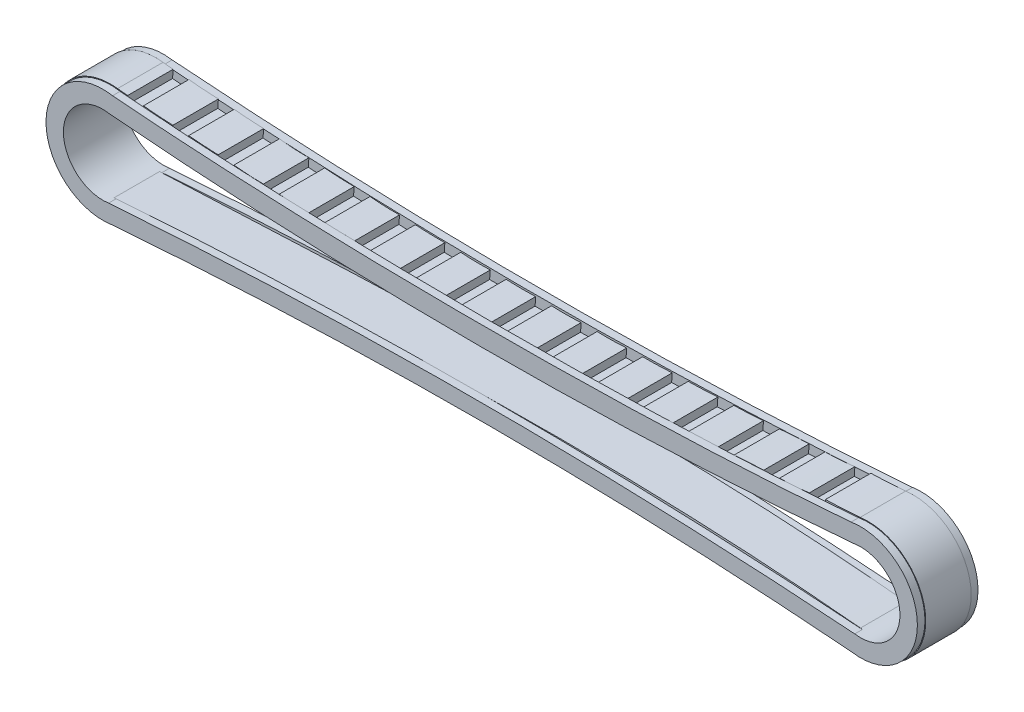
from build123d import *
from build123d.topology import SkipClean

# Parameters (mm, degrees)
BOSS_EXTRUDE1_DEPTH = 30
BOSS_EXTRUDE2_DEPTH = 5
BOSS_EXTRUDE3_START = 5
BOSS_EXTRUDE3_DEPTH = 5


with BuildPart() as part:
    # Sketch2 → Boss-Extrude1 (new body)
    with BuildSketch(Plane.XY):
        with BuildLine():
            Line((-238.998821931, 31.569594808), (-238.586784418, 37.10127655))
            ThreePointArc((-238.586784418, 37.10127655), (-241.931710266, 37.344330699), (-245.266114933, 37.703982975))
            ThreePointArc((-245.266114933, 37.703982975), (-287.989089195, 0.910550459), (-247.077946918, -37.887486137))
            Line((-247.077946918, -37.887486137), (-245.266114933, -37.703982975))
            ThreePointArc((-245.266114933, -37.703982975), (-241.931710266, -37.344330699), (-238.586784418, -37.10127655))
            Line((-238.586784418, -37.10127655), (-238.998821931, -31.569594808))
            add(Edge.make_bspline(
                [(-238.998821931, -31.569594808), (-235.514987298, -31.309699432), (-232.042874885, -31.053245865), (-228.581475166, -30.800398489)],
                knots=[0.02022379, 0.02022379, 0.02022379, 0.02022379, 0.042026375, 0.042026375, 0.042026375, 0.042026375], degree=3))
            Line((-228.581475166, -30.800398489), (-228.172584214, -36.40781281))
            ThreePointArc((-228.172584214, -36.40781281), (-218.470399221, -35.528641015), (-208.741604112, -35.022792798))
            Line((-208.741604112, -35.022792798), (-209.159444416, -29.413207493))
            add(Edge.make_bspline(
                [(-209.159444416, -29.413207493), (-205.675812604, -29.170396225), (-202.201300992, -28.931636256), (-198.73484701, -28.697100604)],
                knots=[0.083029278, 0.083029278, 0.083029278, 0.083029278, 0.105207191, 0.105207191, 0.105207191, 0.105207191], degree=3))
            Line((-198.73484701, -28.697100604), (-198.32562478, -34.309057968))
            ThreePointArc((-198.32562478, -34.309057968), (-188.617482185, -33.521350979), (-178.889417216, -33.038373859))
            Line((-178.889417216, -33.038373859), (-179.30767906, -27.423129293))
            add(Edge.make_bspline(
                [(-179.30767906, -27.423129293), (-175.824275251, -27.202294902), (-172.347090226, -26.986124949), (-168.875020653, -26.774799091)],
                knots=[0.146804407, 0.146804407, 0.146804407, 0.146804407, 0.169262369, 0.169262369, 0.169262369, 0.169262369], degree=3))
            Line((-168.875020653, -26.774799091), (-168.465344429, -32.392982419))
            ThreePointArc((-168.465344429, -32.392982419), (-158.759656192, -31.549674077), (-149.02159256, -31.263894792))
            Line((-149.02159256, -31.263894792), (-149.440416727, -25.64110094))
            add(Edge.make_bspline(
                [(-149.440416727, -25.64110094), (-145.957213896, -25.447051762), (-142.477109799, -25.258262133), (-138.998975623, -25.074915856)],
                knots=[0.211264698, 0.211264698, 0.211264698, 0.211264698, 0.233894228, 0.233894228, 0.233894228, 0.233894228], degree=3))
            Line((-138.998975623, -25.074915856), (-138.588700928, -30.701306436))
            ThreePointArc((-138.588700928, -30.701306436), (-128.872257504, -30.011221888), (-119.135123678, -29.739718012))
            Line((-119.135123678, -29.739718012), (-119.472657229, -25.208266089))
            Line((-119.472657229, -25.208266089), (-119.554671569, -24.107208014))
            add(Edge.make_bspline(
                [(-119.554671569, -24.107208014), (-116.052071462, -23.9434984), (-112.549334144, -23.785668138), (-109.045303404, -23.633905496)],
                knots=[0.276092607, 0.276092607, 0.276092607, 0.276092607, 0.298903759, 0.298903759, 0.298903759, 0.298903759], degree=3))
            Line((-109.045303404, -23.633905496), (-109.045303404, -24.439589833))
            Line((-109.045303404, -24.439589833), (-108.69283219, -29.273279905))
            ThreePointArc((-108.69283219, -29.273279905), (-98.970667218, -28.620073429), (-89.227295134, -28.502298743))
            Line((-89.227295134, -28.502298743), (-89.472657229, -25.208266089))
            Line((-89.472657229, -25.208266089), (-89.647743917, -22.857694114))
            add(Edge.make_bspline(
                [(-89.647743917, -22.857694114), (-86.117447327, -22.728296314), (-82.583691705, -22.605377494), (-79.045303404, -22.489128759)],
                knots=[0.340951975, 0.340951975, 0.340951975, 0.340951975, 0.363877217, 0.363877217, 0.363877217, 0.363877217], degree=3))
            Line((-79.045303404, -22.489128759), (-79.045303404, -24.439589833))
            Line((-79.045303404, -24.439589833), (-78.775215725, -28.143495512))
            ThreePointArc((-78.775215725, -28.143495512), (-69.040667815, -27.684345011), (-59.295833248, -27.582161566))
            Line((-59.295833248, -27.582161566), (-59.472657229, -25.208266089))
            Line((-59.472657229, -25.208266089), (-59.717366768, -21.922994133))
            add(Edge.make_bspline(
                [(-59.717366768, -21.922994133), (-56.167130834, -21.831825833), (-52.610164685, -21.747639789), (-49.045303403, -21.670625684)],
                knots=[0.405505021, 0.405505021, 0.405505021, 0.405505021, 0.428373281, 0.428373281, 0.428373281, 0.428373281], degree=3))
            Line((-49.045303403, -21.670625684), (-49.045303404, -24.439589833))
            Line((-49.045303404, -24.439589833), (-48.833805347, -27.340014089))
            ThreePointArc((-48.833805347, -27.340014089), (-39.090991591, -26.90665667), (-29.339015138, -27.002436507))
            Line((-29.339015138, -27.002436507), (-29.472657229, -25.208266089))
            Line((-29.472657229, -25.208266089), (-29.761814532, -21.326274758))
            add(Edge.make_bspline(
                [(-29.761814532, -21.326274758), (-26.199814592, -21.276116535), (-22.62802131, -21.233325454), (-19.045303404, -21.198085722)],
                knots=[0.469429562, 0.469429562, 0.469429562, 0.469429562, 0.492075527, 0.492075527, 0.492075527, 0.492075527], degree=3))
            Line((-19.045303404, -21.198085722), (-19.045303404, -24.439589833))
            Line((-19.045303404, -24.439589833), (-18.867119733, -26.883150068))
            ThreePointArc((-18.867119733, -26.883150068), (-9.112521987, -26.626736493), (0.644271849, -26.778061131))
            Line((0.644271849, -26.778061131), (0.527342771, -25.208266089))
            Line((0.527342771, -25.208266089), (0.220040245, -21.082671423))
            add(Edge.make_bspline(
                [(0.220040245, -21.082671423), (3.785383745, -21.07505994), (7.363243824, -21.075069823), (10.954696594, -21.082876295)],
                knots=[0.532434088, 0.532434088, 0.532434088, 0.532434088, 0.554705836, 0.554705836, 0.554705836, 0.554705836], degree=3))
            Line((10.954696594, -21.082876295), (10.954696596, -24.439589833))
            Line((10.954696596, -24.439589833), (11.125716762, -26.784911789))
            ThreePointArc((11.125716762, -26.784911789), (20.892293503, -26.526542749), (30.654530324, -26.915783104))
            Line((30.654530324, -26.915783104), (30.527342771, -25.208266089))
            Line((30.527342771, -25.208266089), (30.228725057, -21.199266967))
            add(Edge.make_bspline(
                [(30.228725057, -21.199266967), (33.788907919, -21.234504639), (37.363897011, -21.277485125), (40.954696595, -21.328371949)],
                knots=[0.594268852, 0.594268852, 0.594268852, 0.594268852, 0.616033455, 0.616033455, 0.616033455, 0.616033455], degree=3))
            Line((40.954696595, -21.328371949), (40.954696596, -24.439589833))
            Line((40.954696596, -24.439589833), (41.144996444, -27.049307873))
            ThreePointArc((41.144996444, -27.049307873), (50.923457407, -26.958973121), (60.691703902, -27.414845445))
            Line((60.691703902, -27.414845445), (60.527342771, -25.208266089))
            Line((60.527342771, -25.208266089), (60.26421433, -21.675717091))
            add(Edge.make_bspline(
                [(60.26421433, -21.675717091), (63.810790106, -21.752979285), (67.373977147, -21.837979776), (70.954696596, -21.930868555)],
                knots=[0.654732118, 0.654732118, 0.654732118, 0.654732118, 0.675878863, 0.675878863, 0.675878863, 0.675878863], degree=3))
            Line((70.954696596, -21.930868555), (70.954696596, -24.439589833))
            Line((70.954696596, -24.439589833), (71.190488941, -27.673179044))
            ThreePointArc((71.190488941, -27.673179044), (80.978326974, -27.791319319), (90.755259786, -28.26809524))
            Line((90.755259786, -28.26809524), (90.527342771, -25.208266089))
            Line((90.527342771, -25.208266089), (90.326009866, -22.505333783))
            add(Edge.make_bspline(
                [(90.326009866, -22.505333783), (93.850707609, -22.622842057), (97.393325851, -22.747971609), (100.954696596, -22.880857913)],
                knots=[0.713671686, 0.713671686, 0.713671686, 0.713671686, 0.734113038, 0.734113038, 0.734113038, 0.734113038], degree=3))
            Line((100.954696596, -22.880857913), (100.954696596, -24.439589833))
            Line((100.954696596, -24.439589833), (101.261531792, -28.647440517))
            ThreePointArc((101.261531792, -28.647440517), (111.058477929, -28.921806336), (120.844291485, -29.463362671))
            Line((120.844291485, -29.463362671), (120.527342771, -25.208266089))
            Line((120.527342771, -25.208266089), (120.413239395, -23.676406684))
            add(Edge.make_bspline(
                [(120.413239395, -23.676406684), (123.908056371, -23.831634074), (127.421628301, -23.994270693), (130.954696596, -24.164437269)],
                knots=[0.770982548, 0.770982548, 0.770982548, 0.770982548, 0.790653311, 0.790653311, 0.790653311, 0.790653311], degree=3))
            Line((130.954696596, -24.164437269), (130.954696596, -24.439589833))
            Line((130.954696596, -24.439589833), (131.357132737, -29.958484713))
            ThreePointArc((131.357132737, -29.958484713), (141.16480491, -30.329821804), (150.957622027, -30.984846691))
            Line((150.957622027, -30.984846691), (150.527342771, -25.208266089))
            Line((150.527342771, -25.208266089), (150.524758013, -25.173565233))
            add(Edge.make_bspline(
                [(150.524758013, -25.173565233), (154.014012181, -25.365201145), (157.522780664, -25.56409067), (161.051734721, -25.770343106)],
                knots=[0.826601903, 0.826601903, 0.826601903, 0.826601903, 0.845631572, 0.845631572, 0.845631572, 0.845631572], degree=3))
            Line((161.051734721, -25.770343106), (161.476069116, -31.589544412))
            ThreePointArc((161.476069116, -31.589544412), (171.278353035, -32.308203291), (181.093901171, -32.814420038))
            Line((181.093901171, -32.814420038), (180.659241959, -26.979037702))
            add(Edge.make_bspline(
                [(180.659241959, -26.979037702), (184.149520886, -27.205196053), (187.659872042, -27.438443165), (191.190904523, -27.678878222)],
                knots=[0.880502735, 0.880502735, 0.880502735, 0.880502735, 0.898925873, 0.898925873, 0.898925873, 0.898925873], degree=3))
            Line((191.190904523, -27.678878222), (191.616978023, -33.521929131))
            ThreePointArc((191.616978023, -33.521929131), (201.459551294, -33.876287808), (211.251683623, -34.932679365))
            Line((211.251683623, -34.932679365), (210.815268509, -29.073723721))
            add(Edge.make_bspline(
                [(210.815268509, -29.073723721), (214.306482428, -29.332127355), (217.818095675, -29.597427957), (221.3506597, -29.86971532)],
                knots=[0.932686984, 0.932686984, 0.932686984, 0.932686984, 0.95050946, 0.95050946, 0.95050946, 0.95050946], degree=3))
            Line((221.3506597, -29.86971532), (221.827415786, -36.40781281))
            ThreePointArc((221.827415786, -36.40781281), (233.272455942, -36.896233186), (244.70443965, -37.629204623))
            ThreePointArc((244.70443965, -37.629204623), (288, 0), (244.70443965, 37.629204623))
            ThreePointArc((244.70443965, 37.629204623), (233.272455942, 36.896233186), (221.827415786, 36.40781281))
            Line((221.827415786, 36.40781281), (221.3506597, 29.86971532))
            add(Edge.make_bspline(
                [(210.815268509, 29.073723721), (214.306482428, 29.332127355), (217.818095675, 29.597427957), (221.3506597, 29.86971532)],
                knots=[0.932686984, 0.932686984, 0.932686984, 0.932686984, 0.95050946, 0.95050946, 0.95050946, 0.95050946], degree=3))
            Line((210.815268509, 29.073723721), (211.251683623, 34.932679365))
            ThreePointArc((211.251683623, 34.932679365), (201.459551294, 33.876287808), (191.616978023, 33.521929131))
            Line((191.616978023, 33.521929131), (191.190904523, 27.678878222))
            add(Edge.make_bspline(
                [(180.659241959, 26.979037702), (184.149520886, 27.205196053), (187.659872042, 27.438443165), (191.190904523, 27.678878222)],
                knots=[0.880502735, 0.880502735, 0.880502735, 0.880502735, 0.898925873, 0.898925873, 0.898925873, 0.898925873], degree=3))
            Line((180.659241959, 26.979037702), (181.093901171, 32.814420038))
            ThreePointArc((181.093901171, 32.814420038), (171.278353035, 32.308203291), (161.476069116, 31.589544412))
            Line((161.476069116, 31.589544412), (161.051734721, 25.770343106))
            add(Edge.make_bspline(
                [(150.524758013, 25.173565233), (154.014012181, 25.365201145), (157.522780664, 25.56409067), (161.051734721, 25.770343106)],
                knots=[0.826601903, 0.826601903, 0.826601903, 0.826601903, 0.845631572, 0.845631572, 0.845631572, 0.845631572], degree=3))
            Line((150.524758013, 25.173565233), (150.527342771, 25.208266089))
            Line((150.527342771, 25.208266089), (150.957622027, 30.984846691))
            ThreePointArc((150.957622027, 30.984846691), (141.16480491, 30.329821804), (131.357132737, 29.958484713))
            Line((131.357132737, 29.958484713), (130.954696596, 24.439589833))
            Line((130.954696596, 24.439589833), (130.954696596, 24.164437269))
            add(Edge.make_bspline(
                [(120.413239395, 23.676406684), (123.908056371, 23.831634074), (127.421628301, 23.994270693), (130.954696596, 24.164437269)],
                knots=[0.770982548, 0.770982548, 0.770982548, 0.770982548, 0.790653311, 0.790653311, 0.790653311, 0.790653311], degree=3))
            Line((120.413239395, 23.676406684), (120.527342771, 25.208266089))
            Line((120.527342771, 25.208266089), (120.844291485, 29.463362671))
            ThreePointArc((120.844291485, 29.463362671), (111.058477929, 28.921806336), (101.261531792, 28.647440517))
            Line((101.261531792, 28.647440517), (100.954696596, 24.439589833))
            Line((100.954696596, 24.439589833), (100.954696596, 22.880857913))
            add(Edge.make_bspline(
                [(90.326009866, 22.505333783), (93.850707609, 22.622842057), (97.393325851, 22.747971609), (100.954696596, 22.880857913)],
                knots=[0.713671686, 0.713671686, 0.713671686, 0.713671686, 0.734113038, 0.734113038, 0.734113038, 0.734113038], degree=3))
            Line((90.326009866, 22.505333783), (90.527342771, 25.208266089))
            Line((90.527342771, 25.208266089), (90.755259786, 28.26809524))
            ThreePointArc((90.755259786, 28.26809524), (80.978326974, 27.791319319), (71.190488941, 27.673179044))
            Line((71.190488941, 27.673179044), (70.954696596, 24.439589833))
            Line((70.954696596, 24.439589833), (70.954696596, 21.930868555))
            add(Edge.make_bspline(
                [(60.26421433, 21.675717091), (63.810790106, 21.752979285), (67.373977147, 21.837979776), (70.954696596, 21.930868555)],
                knots=[0.654732118, 0.654732118, 0.654732118, 0.654732118, 0.675878863, 0.675878863, 0.675878863, 0.675878863], degree=3))
            Line((60.26421433, 21.675717091), (60.527342771, 25.208266089))
            Line((60.527342771, 25.208266089), (60.691703902, 27.414845445))
            ThreePointArc((60.691703902, 27.414845445), (50.923457407, 26.958973121), (41.144996444, 27.049307873))
            Line((41.144996444, 27.049307873), (40.954696596, 24.439589833))
            Line((40.954696596, 24.439589833), (40.954696595, 21.328371949))
            add(Edge.make_bspline(
                [(30.228725057, 21.199266967), (33.788907919, 21.234504639), (37.363897011, 21.277485125), (40.954696595, 21.328371949)],
                knots=[0.594268852, 0.594268852, 0.594268852, 0.594268852, 0.616033455, 0.616033455, 0.616033455, 0.616033455], degree=3))
            Line((30.228725057, 21.199266967), (30.527342771, 25.208266089))
            Line((30.527342771, 25.208266089), (30.654530324, 26.915783104))
            ThreePointArc((30.654530324, 26.915783104), (20.892293503, 26.526542749), (11.125716762, 26.784911789))
            Line((11.125716762, 26.784911789), (10.954696596, 24.439589833))
            Line((10.954696596, 24.439589833), (10.954696594, 21.082876295))
            add(Edge.make_bspline(
                [(0.220040245, 21.082671423), (3.785383745, 21.07505994), (7.363243824, 21.075069823), (10.954696594, 21.082876295)],
                knots=[0.532434088, 0.532434088, 0.532434088, 0.532434088, 0.554705836, 0.554705836, 0.554705836, 0.554705836], degree=3))
            Line((0.220040245, 21.082671423), (0.527342771, 25.208266089))
            Line((0.527342771, 25.208266089), (0.644271849, 26.778061131))
            ThreePointArc((0.644271849, 26.778061131), (-9.112521987, 26.626736493), (-18.867119733, 26.883150068))
            Line((-18.867119733, 26.883150068), (-19.045303404, 24.439589833))
            Line((-19.045303404, 24.439589833), (-19.045303404, 21.198085722))
            add(Edge.make_bspline(
                [(-29.761814532, 21.326274758), (-26.199814592, 21.276116535), (-22.62802131, 21.233325454), (-19.045303404, 21.198085722)],
                knots=[0.469429562, 0.469429562, 0.469429562, 0.469429562, 0.492075527, 0.492075527, 0.492075527, 0.492075527], degree=3))
            Line((-29.761814532, 21.326274758), (-29.472657229, 25.208266089))
            Line((-29.472657229, 25.208266089), (-29.339015138, 27.002436507))
            ThreePointArc((-29.339015138, 27.002436507), (-39.090991591, 26.90665667), (-48.833805347, 27.340014089))
            Line((-48.833805347, 27.340014089), (-49.045303404, 24.439589833))
            Line((-49.045303404, 24.439589833), (-49.045303403, 21.670625684))
            add(Edge.make_bspline(
                [(-59.717366768, 21.922994133), (-56.167130834, 21.831825833), (-52.610164685, 21.747639789), (-49.045303403, 21.670625684)],
                knots=[0.405505021, 0.405505021, 0.405505021, 0.405505021, 0.428373281, 0.428373281, 0.428373281, 0.428373281], degree=3))
            Line((-59.717366768, 21.922994133), (-59.472657229, 25.208266089))
            Line((-59.472657229, 25.208266089), (-59.295833248, 27.582161566))
            ThreePointArc((-59.295833248, 27.582161566), (-69.040667815, 27.684345011), (-78.775215725, 28.143495512))
            Line((-78.775215725, 28.143495512), (-79.045303404, 24.439589833))
            Line((-79.045303404, 24.439589833), (-79.045303404, 22.489128759))
            add(Edge.make_bspline(
                [(-89.647743917, 22.857694114), (-86.117447327, 22.728296314), (-82.583691705, 22.605377494), (-79.045303404, 22.489128759)],
                knots=[0.340951975, 0.340951975, 0.340951975, 0.340951975, 0.363877217, 0.363877217, 0.363877217, 0.363877217], degree=3))
            Line((-89.647743917, 22.857694114), (-89.472657229, 25.208266089))
            Line((-89.472657229, 25.208266089), (-89.227295134, 28.502298743))
            ThreePointArc((-89.227295134, 28.502298743), (-98.970667218, 28.620073429), (-108.69283219, 29.273279905))
            Line((-108.69283219, 29.273279905), (-109.045303404, 24.439589833))
            Line((-109.045303404, 24.439589833), (-109.045303404, 23.633905496))
            add(Edge.make_bspline(
                [(-119.554671569, 24.107208014), (-116.052071462, 23.9434984), (-112.549334144, 23.785668138), (-109.045303404, 23.633905496)],
                knots=[0.276092607, 0.276092607, 0.276092607, 0.276092607, 0.298903759, 0.298903759, 0.298903759, 0.298903759], degree=3))
            Line((-119.554671569, 24.107208014), (-119.472657229, 25.208266089))
            Line((-119.472657229, 25.208266089), (-119.135123678, 29.739718012))
            ThreePointArc((-119.135123678, 29.739718012), (-128.872257504, 30.011221888), (-138.588700928, 30.701306436))
            Line((-138.588700928, 30.701306436), (-138.998975623, 25.074915856))
            add(Edge.make_bspline(
                [(-149.440416727, 25.64110094), (-145.957213896, 25.447051762), (-142.477109799, 25.258262133), (-138.998975623, 25.074915856)],
                knots=[0.211264698, 0.211264698, 0.211264698, 0.211264698, 0.233894228, 0.233894228, 0.233894228, 0.233894228], degree=3))
            Line((-149.440416727, 25.64110094), (-149.02159256, 31.263894792))
            ThreePointArc((-149.02159256, 31.263894792), (-158.759656192, 31.549674077), (-168.465344429, 32.392982419))
            Line((-168.465344429, 32.392982419), (-168.875020653, 26.774799091))
            add(Edge.make_bspline(
                [(-179.30767906, 27.423129293), (-175.824275251, 27.202294902), (-172.347090226, 26.986124949), (-168.875020653, 26.774799091)],
                knots=[0.146804407, 0.146804407, 0.146804407, 0.146804407, 0.169262369, 0.169262369, 0.169262369, 0.169262369], degree=3))
            Line((-179.30767906, 27.423129293), (-178.889417216, 33.038373859))
            ThreePointArc((-178.889417216, 33.038373859), (-188.617482185, 33.521350979), (-198.32562478, 34.309057968))
            Line((-198.32562478, 34.309057968), (-198.73484701, 28.697100604))
            add(Edge.make_bspline(
                [(-209.159444416, 29.413207493), (-205.675812604, 29.170396225), (-202.201300992, 28.931636256), (-198.73484701, 28.697100604)],
                knots=[0.083029278, 0.083029278, 0.083029278, 0.083029278, 0.105207191, 0.105207191, 0.105207191, 0.105207191], degree=3))
            Line((-209.159444416, 29.413207493), (-208.741604112, 35.022792798))
            ThreePointArc((-208.741604112, 35.022792798), (-218.470399221, 35.528641015), (-228.172584214, 36.40781281))
            Line((-228.172584214, 36.40781281), (-228.581475166, 30.800398489))
            add(Edge.make_bspline(
                [(-238.998821931, 31.569594808), (-235.514987298, 31.309699432), (-232.042874885, 31.053245865), (-228.581475166, 30.800398489)],
                knots=[0.02022379, 0.02022379, 0.02022379, 0.02022379, 0.042026375, 0.042026375, 0.042026375, 0.042026375], degree=3))
        make_face()
        with BuildLine():
            add(Edge.make_bspline(
                [(-246.088630276, 25.704108366), (-161.718455908, 19.343060967), (-84.497237543, 14.932126917), (-0.249462592, 14.779506817)],
                knots=[0.008117575, 0.008117575, 0.008117575, 0.008117575, 0.534111797, 0.534111797, 0.534111797, 0.534111797], degree=3))
            add(Edge.make_bspline(
                [(-0.249462592, 14.779506817), (0.144425016, 14.778793265), (0.538466217, 14.778172795), (0.932662459, 14.777645642)],
                knots=[0.534111797, 0.534111797, 0.534111797, 0.534111797, 0.536571002, 0.536571002, 0.536571002, 0.536571002], degree=3))
            Line((0.932662459, 14.777645642), (7.596564193, 14.777645642))
            add(Edge.make_bspline(
                [(7.596564193, 14.777645642), (8.714629839, 14.779141076), (9.833996435, 14.781391027), (10.95469659, 14.784400807)],
                knots=[0.550397545, 0.550397545, 0.550397545, 0.550397545, 0.557341117, 0.557341117, 0.557341117, 0.557341117], degree=3))
            add(Edge.make_bspline(
                [(10.95469659, 14.784400807), (81.24887038, 14.973184562), (156.78957132, 18.151307273), (245.623806484, 25.629064172)],
                knots=[0.557341117, 0.557341117, 0.557341117, 0.557341117, 0.992865871, 0.992865871, 0.992865871, 0.992865871], degree=3))
            ThreePointArc((245.623806484, 25.629064172), (275.99757223, -0.355300092), (244.925044116, -25.499898486))
            add(Edge.make_bspline(
                [(-247.588061303, -25.887884265), (-61.037823008, -17.212811955), (82.735115506, -9.740894642), (244.925044116, -25.499898486)],
                knots=[0.004242992, 0.004242992, 0.004242992, 0.004242992, 0.989733551, 0.989733551, 0.989733551, 0.989733551], degree=3))
            ThreePointArc((-247.588061303, -25.887884265), (-275.989026208, 0.755325589), (-246.088630276, 25.704108366))
        make_face(mode=Mode.SUBTRACT)
    extrude(amount=BOSS_EXTRUDE1_DEPTH)

    # Sketch4 → Boss-Extrude2 (add)
    with SkipClean():  # the faces are left unmerged after this step: merging them gives an invalid solid
        with BuildSketch(Plane.XY.offset(30)):
            with BuildLine():
                ThreePointArc((-243.570324123, 36.944678482), (-287.498897188, 0.28759288), (-244.137731871, -37.038949936))
                add(Edge.make_bspline(
                    [(-244.137731871, -37.038949936), (-87.891725971, -24.889906594), (75.217571222, -23.34735127), (243.891684591, -36.999168678)],
                    knots=[0.012213178, 0.012213178, 0.012213178, 0.012213178, 0.988223038, 0.988223038, 0.988223038, 0.988223038], degree=3))
                ThreePointArc((243.891684591, -36.999168678), (287.499907624, 0.08323587), (243.727496758, 36.971687858))
                add(Edge.make_bspline(
                    [(-243.570324123, 36.944678482), (-105.415169779, 25.255884921), (89.573562251, 24.222943341), (243.727496758, 36.971687858)],
                    knots=[0.015170964, 0.015170964, 0.015170964, 0.015170964, 0.98677366, 0.98677366, 0.98677366, 0.98677366], degree=3))
            make_face()
            with BuildLine():
                ThreePointArc((-245.495685997, 25.606857351), (-275.997741347, 0.342684838), (-246.172198615, -25.716685723))
                ThreePointArc((-246.172198615, -25.716685723), (-5.29e-07, -16.689307506), (246.172197553, -25.716685798))
                ThreePointArc((246.172197553, -25.716685798), (275.997741584, 0.342684334), (245.495685933, 25.606857574))
                ThreePointArc((245.495685933, 25.606857574), (-2.7e-08, 15.011167118), (-245.495685997, 25.606857351))
            make_face(mode=Mode.SUBTRACT)
        extrude(amount=BOSS_EXTRUDE2_DEPTH)

    # Sketch5 → Boss-Extrude3 (add)
    with BuildSketch(Plane(origin=(0, 0, 0), x_dir=(-1, 0, 0), z_dir=(0, 0, -1)).offset(BOSS_EXTRUDE3_START)):
        with BuildLine():
            ThreePointArc((-243.586757303, -36.947534669), (0, -26.611672927), (243.586757303, -36.947534669))
            ThreePointArc((243.586757303, -36.947534669), (287.498300398, -0.357025613), (244.291419585, 37.062947935))
            ThreePointArc((244.291419585, 37.062947935), (0, 27.833225662), (-244.291419585, 37.062947935))
            ThreePointArc((-244.291419585, 37.062947935), (-287.498300398, -0.357025613), (-243.586757303, -36.947534669))
        make_face()
        with BuildLine():
            ThreePointArc((-245.146134485, 25.542904877), (-275.996399352, 0.432690109), (-245.998871672, -25.690289451))
            ThreePointArc((-245.998871672, -25.690289451), (0, -16.260555126), (245.998871672, -25.690289451))
            ThreePointArc((245.998871672, -25.690289451), (275.996399352, 0.432690109), (245.146134485, 25.542904877))
            ThreePointArc((245.146134485, 25.542904877), (0, 14.138911534), (-245.146134485, 25.542904877))
        make_face(mode=Mode.SUBTRACT)
    extrude(amount=-BOSS_EXTRUDE3_DEPTH)


solid = part.part
